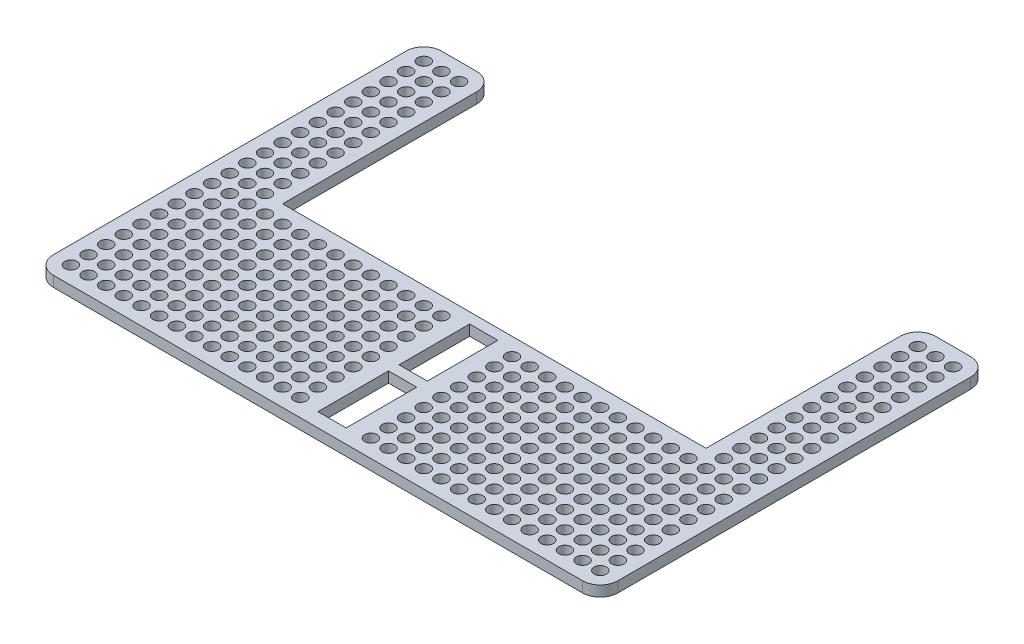
from build123d import *

# Parameters (mm, degrees)
SKETCH1_R           = 1.75
BOSS_EXTRUDE1_DEPTH = 3


with BuildPart() as part:
    # Sketch1 → Boss-Extrude1 (new body)
    with BuildSketch(Plane(origin=(0, 0, 0), x_dir=(1, 0, 0), z_dir=(0, 1, 0))):
        with BuildLine():
            Line((0, -20), (-60, -20))
            Line((-60, -20), (-60, 35))
            ThreePointArc((-60, 35), (-61.464466094, 38.535533906), (-65, 40))
            Line((-65, 40), (-75, 40))
            ThreePointArc((-75, 40), (-78.535533906, 38.535533906), (-80, 35))
            Line((-80, 35), (-80, -65))
            ThreePointArc((-80, -65), (-78.535533906, -68.535533906), (-75, -70))
            Line((-75, -70), (0, -70))
            Line((0, -70), (0, -66))
            Line((0, -66), (-4, -66))
            Line((-4, -66), (-4, -46))
            Line((-4, -46), (0, -46))
            Line((0, -46), (0, -43))
            Line((0, -43), (-4, -43))
            Line((-4, -43), (-4, -23))
            Line((-4, -23), (0, -23))
            Line((0, -23), (0, -20))
        make_face()
        with Locations(Location((-65, 0, 0), (0, 0, 270))):
            Circle(SKETCH1_R, mode=Mode.SUBTRACT)
        with Locations(Location((-70, 0, 0), (0, 0, 270))):
            Circle(SKETCH1_R, mode=Mode.SUBTRACT)
        with Locations(Location((-75, 0, 0), (0, 0, 270))):
            Circle(SKETCH1_R, mode=Mode.SUBTRACT)
        with Locations(Location((-75, 5, 0), (0, 0, 270))):
            Circle(SKETCH1_R, mode=Mode.SUBTRACT)
        with Locations(Location((-70, 5, 0), (0, 0, 270))):
            Circle(SKETCH1_R, mode=Mode.SUBTRACT)
        with Locations(Location((-65, 5, 0), (0, 0, 270))):
            Circle(SKETCH1_R, mode=Mode.SUBTRACT)
        with Locations(Location((-75, 10, 0), (0, 0, 270))):
            Circle(SKETCH1_R, mode=Mode.SUBTRACT)
        with Locations(Location((-70, 10, 0), (0, 0, 270))):
            Circle(SKETCH1_R, mode=Mode.SUBTRACT)
        with Locations(Location((-65, 10, 0), (0, 0, 270))):
            Circle(SKETCH1_R, mode=Mode.SUBTRACT)
        with Locations(Location((-75, 15, 0), (0, 0, 270))):
            Circle(SKETCH1_R, mode=Mode.SUBTRACT)
        with Locations(Location((-70, 15, 0), (0, 0, 270))):
            Circle(SKETCH1_R, mode=Mode.SUBTRACT)
        with Locations(Location((-65, 15, 0), (0, 0, 270))):
            Circle(SKETCH1_R, mode=Mode.SUBTRACT)
        with Locations(Location((-75, 20, 0), (0, 0, 270))):
            Circle(SKETCH1_R, mode=Mode.SUBTRACT)
        with Locations(Location((-70, 20, 0), (0, 0, 270))):
            Circle(SKETCH1_R, mode=Mode.SUBTRACT)
        with Locations(Location((-65, 20, 0), (0, 0, 270))):
            Circle(SKETCH1_R, mode=Mode.SUBTRACT)
        with Locations(Location((-75, 25, 0), (0, 0, 270))):
            Circle(SKETCH1_R, mode=Mode.SUBTRACT)
        with Locations(Location((-70, 25, 0), (0, 0, 270))):
            Circle(SKETCH1_R, mode=Mode.SUBTRACT)
        with Locations(Location((-65, 25, 0), (0, 0, 270))):
            Circle(SKETCH1_R, mode=Mode.SUBTRACT)
        with Locations(Location((-75, 30, 0), (0, 0, 270))):
            Circle(SKETCH1_R, mode=Mode.SUBTRACT)
        with Locations(Location((-70, 30, 0), (0, 0, 270))):
            Circle(SKETCH1_R, mode=Mode.SUBTRACT)
        with Locations(Location((-65, 30, 0), (0, 0, 270))):
            Circle(SKETCH1_R, mode=Mode.SUBTRACT)
        with Locations(Location((-75, 35, 0), (0, 0, 270))):
            Circle(SKETCH1_R, mode=Mode.SUBTRACT)
        with Locations(Location((-70, 35, 0), (0, 0, 270))):
            Circle(SKETCH1_R, mode=Mode.SUBTRACT)
        with Locations(Location((-65, 35, 0), (0, 0, 270))):
            Circle(SKETCH1_R, mode=Mode.SUBTRACT)
        with Locations(Location((-75, -5, 0), (0, 0, 270))):
            Circle(SKETCH1_R, mode=Mode.SUBTRACT)
        with Locations(Location((-70, -5, 0), (0, 0, 270))):
            Circle(SKETCH1_R, mode=Mode.SUBTRACT)
        with Locations(Location((-65, -5, 0), (0, 0, 270))):
            Circle(SKETCH1_R, mode=Mode.SUBTRACT)
        with Locations(Location((-75, -10, 0), (0, 0, 270))):
            Circle(SKETCH1_R, mode=Mode.SUBTRACT)
        with Locations(Location((-70, -10, 0), (0, 0, 270))):
            Circle(SKETCH1_R, mode=Mode.SUBTRACT)
        with Locations(Location((-65, -10, 0), (0, 0, 270))):
            Circle(SKETCH1_R, mode=Mode.SUBTRACT)
        with Locations(Location((-75, -15, 0), (0, 0, 270))):
            Circle(SKETCH1_R, mode=Mode.SUBTRACT)
        with Locations(Location((-70, -15, 0), (0, 0, 270))):
            Circle(SKETCH1_R, mode=Mode.SUBTRACT)
        with Locations(Location((-65, -15, 0), (0, 0, 270))):
            Circle(SKETCH1_R, mode=Mode.SUBTRACT)
        with Locations(Location((-75, -20, 0), (0, 0, 270))):
            Circle(SKETCH1_R, mode=Mode.SUBTRACT)
        with Locations(Location((-70, -20, 0), (0, 0, 270))):
            Circle(SKETCH1_R, mode=Mode.SUBTRACT)
        with Locations(Location((-65, -20, 0), (0, 0, 270))):
            Circle(SKETCH1_R, mode=Mode.SUBTRACT)
        with Locations(Location((-75, -25, 0), (0, 0, 270))):
            Circle(SKETCH1_R, mode=Mode.SUBTRACT)
        with Locations(Location((-70, -25, 0), (0, 0, 270))):
            Circle(SKETCH1_R, mode=Mode.SUBTRACT)
        with Locations(Location((-65, -25, 0), (0, 0, 270))):
            Circle(SKETCH1_R, mode=Mode.SUBTRACT)
        with Locations(Location((-75, -30, 0), (0, 0, 270))):
            Circle(SKETCH1_R, mode=Mode.SUBTRACT)
        with Locations(Location((-70, -30, 0), (0, 0, 270))):
            Circle(SKETCH1_R, mode=Mode.SUBTRACT)
        with Locations(Location((-65, -30, 0), (0, 0, 270))):
            Circle(SKETCH1_R, mode=Mode.SUBTRACT)
        with Locations(Location((-75, -35, 0), (0, 0, 270))):
            Circle(SKETCH1_R, mode=Mode.SUBTRACT)
        with Locations(Location((-70, -35, 0), (0, 0, 270))):
            Circle(SKETCH1_R, mode=Mode.SUBTRACT)
        with Locations(Location((-65, -35, 0), (0, 0, 270))):
            Circle(SKETCH1_R, mode=Mode.SUBTRACT)
        with Locations(Location((-75, -40, 0), (0, 0, 270))):
            Circle(SKETCH1_R, mode=Mode.SUBTRACT)
        with Locations(Location((-70, -40, 0), (0, 0, 270))):
            Circle(SKETCH1_R, mode=Mode.SUBTRACT)
        with Locations(Location((-65, -40, 0), (0, 0, 270))):
            Circle(SKETCH1_R, mode=Mode.SUBTRACT)
        with Locations(Location((-75, -45, 0), (0, 0, 270))):
            Circle(SKETCH1_R, mode=Mode.SUBTRACT)
        with Locations(Location((-70, -45, 0), (0, 0, 270))):
            Circle(SKETCH1_R, mode=Mode.SUBTRACT)
        with Locations(Location((-65, -45, 0), (0, 0, 270))):
            Circle(SKETCH1_R, mode=Mode.SUBTRACT)
        with Locations(Location((-75, -50, 0), (0, 0, 270))):
            Circle(SKETCH1_R, mode=Mode.SUBTRACT)
        with Locations(Location((-70, -50, 0), (0, 0, 270))):
            Circle(SKETCH1_R, mode=Mode.SUBTRACT)
        with Locations(Location((-65, -50, 0), (0, 0, 270))):
            Circle(SKETCH1_R, mode=Mode.SUBTRACT)
        with Locations(Location((-75, -55, 0), (0, 0, 270))):
            Circle(SKETCH1_R, mode=Mode.SUBTRACT)
        with Locations(Location((-70, -55, 0), (0, 0, 270))):
            Circle(SKETCH1_R, mode=Mode.SUBTRACT)
        with Locations(Location((-65, -55, 0), (0, 0, 270))):
            Circle(SKETCH1_R, mode=Mode.SUBTRACT)
        with Locations(Location((-75, -60, 0), (0, 0, 270))):
            Circle(SKETCH1_R, mode=Mode.SUBTRACT)
        with Locations(Location((-70, -60, 0), (0, 0, 270))):
            Circle(SKETCH1_R, mode=Mode.SUBTRACT)
        with Locations(Location((-65, -60, 0), (0, 0, 270))):
            Circle(SKETCH1_R, mode=Mode.SUBTRACT)
        with Locations(Location((-75, -65, 0), (0, 0, 270))):
            Circle(SKETCH1_R, mode=Mode.SUBTRACT)
        with Locations(Location((-70, -65, 0), (0, 0, 270))):
            Circle(SKETCH1_R, mode=Mode.SUBTRACT)
        with Locations(Location((-65, -65, 0), (0, 0, 270))):
            Circle(SKETCH1_R, mode=Mode.SUBTRACT)
        with Locations(Location((-60, -65, 0), (0, 0, 270))):
            Circle(SKETCH1_R, mode=Mode.SUBTRACT)
        with Locations(Location((-60, -60, 0), (0, 0, 270))):
            Circle(SKETCH1_R, mode=Mode.SUBTRACT)
        with Locations(Location((-60, -55, 0), (0, 0, 270))):
            Circle(SKETCH1_R, mode=Mode.SUBTRACT)
        with Locations(Location((-60, -50, 0), (0, 0, 270))):
            Circle(SKETCH1_R, mode=Mode.SUBTRACT)
        with Locations(Location((-60, -45, 0), (0, 0, 270))):
            Circle(SKETCH1_R, mode=Mode.SUBTRACT)
        with Locations(Location((-60, -40, 0), (0, 0, 270))):
            Circle(SKETCH1_R, mode=Mode.SUBTRACT)
        with Locations(Location((-60, -35, 0), (0, 0, 270))):
            Circle(SKETCH1_R, mode=Mode.SUBTRACT)
        with Locations(Location((-60, -30, 0), (0, 0, 270))):
            Circle(SKETCH1_R, mode=Mode.SUBTRACT)
        with Locations(Location((-60, -25, 0), (0, 0, 270))):
            Circle(SKETCH1_R, mode=Mode.SUBTRACT)
        with Locations(Location((-55, -65, 0), (0, 0, 270))):
            Circle(SKETCH1_R, mode=Mode.SUBTRACT)
        with Locations(Location((-55, -60, 0), (0, 0, 270))):
            Circle(SKETCH1_R, mode=Mode.SUBTRACT)
        with Locations(Location((-55, -55, 0), (0, 0, 270))):
            Circle(SKETCH1_R, mode=Mode.SUBTRACT)
        with Locations(Location((-55, -50, 0), (0, 0, 270))):
            Circle(SKETCH1_R, mode=Mode.SUBTRACT)
        with Locations(Location((-55, -45, 0), (0, 0, 270))):
            Circle(SKETCH1_R, mode=Mode.SUBTRACT)
        with Locations(Location((-55, -40, 0), (0, 0, 270))):
            Circle(SKETCH1_R, mode=Mode.SUBTRACT)
        with Locations(Location((-55, -35, 0), (0, 0, 270))):
            Circle(SKETCH1_R, mode=Mode.SUBTRACT)
        with Locations(Location((-55, -30, 0), (0, 0, 270))):
            Circle(SKETCH1_R, mode=Mode.SUBTRACT)
        with Locations(Location((-55, -25, 0), (0, 0, 270))):
            Circle(SKETCH1_R, mode=Mode.SUBTRACT)
        with Locations(Location((-50, -65, 0), (0, 0, 270))):
            Circle(SKETCH1_R, mode=Mode.SUBTRACT)
        with Locations(Location((-50, -60, 0), (0, 0, 270))):
            Circle(SKETCH1_R, mode=Mode.SUBTRACT)
        with Locations(Location((-50, -55, 0), (0, 0, 270))):
            Circle(SKETCH1_R, mode=Mode.SUBTRACT)
        with Locations(Location((-50, -50, 0), (0, 0, 270))):
            Circle(SKETCH1_R, mode=Mode.SUBTRACT)
        with Locations(Location((-50, -45, 0), (0, 0, 270))):
            Circle(SKETCH1_R, mode=Mode.SUBTRACT)
        with Locations(Location((-50, -40, 0), (0, 0, 270))):
            Circle(SKETCH1_R, mode=Mode.SUBTRACT)
        with Locations(Location((-50, -35, 0), (0, 0, 270))):
            Circle(SKETCH1_R, mode=Mode.SUBTRACT)
        with Locations(Location((-50, -30, 0), (0, 0, 270))):
            Circle(SKETCH1_R, mode=Mode.SUBTRACT)
        with Locations(Location((-50, -25, 0), (0, 0, 270))):
            Circle(SKETCH1_R, mode=Mode.SUBTRACT)
        with Locations(Location((-45, -65, 0), (0, 0, 270))):
            Circle(SKETCH1_R, mode=Mode.SUBTRACT)
        with Locations(Location((-45, -60, 0), (0, 0, 270))):
            Circle(SKETCH1_R, mode=Mode.SUBTRACT)
        with Locations(Location((-45, -55, 0), (0, 0, 270))):
            Circle(SKETCH1_R, mode=Mode.SUBTRACT)
        with Locations(Location((-45, -50, 0), (0, 0, 270))):
            Circle(SKETCH1_R, mode=Mode.SUBTRACT)
        with Locations(Location((-45, -45, 0), (0, 0, 270))):
            Circle(SKETCH1_R, mode=Mode.SUBTRACT)
        with Locations(Location((-45, -40, 0), (0, 0, 270))):
            Circle(SKETCH1_R, mode=Mode.SUBTRACT)
        with Locations(Location((-45, -35, 0), (0, 0, 270))):
            Circle(SKETCH1_R, mode=Mode.SUBTRACT)
        with Locations(Location((-45, -30, 0), (0, 0, 270))):
            Circle(SKETCH1_R, mode=Mode.SUBTRACT)
        with Locations(Location((-45, -25, 0), (0, 0, 270))):
            Circle(SKETCH1_R, mode=Mode.SUBTRACT)
        with Locations(Location((-40, -65, 0), (0, 0, 270))):
            Circle(SKETCH1_R, mode=Mode.SUBTRACT)
        with Locations(Location((-40, -60, 0), (0, 0, 270))):
            Circle(SKETCH1_R, mode=Mode.SUBTRACT)
        with Locations(Location((-40, -55, 0), (0, 0, 270))):
            Circle(SKETCH1_R, mode=Mode.SUBTRACT)
        with Locations(Location((-40, -50, 0), (0, 0, 270))):
            Circle(SKETCH1_R, mode=Mode.SUBTRACT)
        with Locations(Location((-40, -45, 0), (0, 0, 270))):
            Circle(SKETCH1_R, mode=Mode.SUBTRACT)
        with Locations(Location((-40, -40, 0), (0, 0, 270))):
            Circle(SKETCH1_R, mode=Mode.SUBTRACT)
        with Locations(Location((-40, -35, 0), (0, 0, 270))):
            Circle(SKETCH1_R, mode=Mode.SUBTRACT)
        with Locations(Location((-40, -30, 0), (0, 0, 270))):
            Circle(SKETCH1_R, mode=Mode.SUBTRACT)
        with Locations(Location((-40, -25, 0), (0, 0, 270))):
            Circle(SKETCH1_R, mode=Mode.SUBTRACT)
        with Locations(Location((-35, -65, 0), (0, 0, 270))):
            Circle(SKETCH1_R, mode=Mode.SUBTRACT)
        with Locations(Location((-35, -60, 0), (0, 0, 270))):
            Circle(SKETCH1_R, mode=Mode.SUBTRACT)
        with Locations(Location((-35, -55, 0), (0, 0, 270))):
            Circle(SKETCH1_R, mode=Mode.SUBTRACT)
        with Locations(Location((-35, -50, 0), (0, 0, 270))):
            Circle(SKETCH1_R, mode=Mode.SUBTRACT)
        with Locations(Location((-35, -45, 0), (0, 0, 270))):
            Circle(SKETCH1_R, mode=Mode.SUBTRACT)
        with Locations(Location((-35, -40, 0), (0, 0, 270))):
            Circle(SKETCH1_R, mode=Mode.SUBTRACT)
        with Locations(Location((-35, -35, 0), (0, 0, 270))):
            Circle(SKETCH1_R, mode=Mode.SUBTRACT)
        with Locations(Location((-35, -30, 0), (0, 0, 270))):
            Circle(SKETCH1_R, mode=Mode.SUBTRACT)
        with Locations(Location((-35, -25, 0), (0, 0, 270))):
            Circle(SKETCH1_R, mode=Mode.SUBTRACT)
        with Locations(Location((-30, -65, 0), (0, 0, 270))):
            Circle(SKETCH1_R, mode=Mode.SUBTRACT)
        with Locations(Location((-30, -60, 0), (0, 0, 270))):
            Circle(SKETCH1_R, mode=Mode.SUBTRACT)
        with Locations(Location((-30, -55, 0), (0, 0, 270))):
            Circle(SKETCH1_R, mode=Mode.SUBTRACT)
        with Locations(Location((-30, -50, 0), (0, 0, 270))):
            Circle(SKETCH1_R, mode=Mode.SUBTRACT)
        with Locations(Location((-30, -45, 0), (0, 0, 270))):
            Circle(SKETCH1_R, mode=Mode.SUBTRACT)
        with Locations(Location((-30, -40, 0), (0, 0, 270))):
            Circle(SKETCH1_R, mode=Mode.SUBTRACT)
        with Locations(Location((-30, -35, 0), (0, 0, 270))):
            Circle(SKETCH1_R, mode=Mode.SUBTRACT)
        with Locations(Location((-30, -30, 0), (0, 0, 270))):
            Circle(SKETCH1_R, mode=Mode.SUBTRACT)
        with Locations(Location((-30, -25, 0), (0, 0, 270))):
            Circle(SKETCH1_R, mode=Mode.SUBTRACT)
        with Locations(Location((-25, -65, 0), (0, 0, 270))):
            Circle(SKETCH1_R, mode=Mode.SUBTRACT)
        with Locations(Location((-25, -60, 0), (0, 0, 270))):
            Circle(SKETCH1_R, mode=Mode.SUBTRACT)
        with Locations(Location((-25, -55, 0), (0, 0, 270))):
            Circle(SKETCH1_R, mode=Mode.SUBTRACT)
        with Locations(Location((-25, -50, 0), (0, 0, 270))):
            Circle(SKETCH1_R, mode=Mode.SUBTRACT)
        with Locations(Location((-25, -45, 0), (0, 0, 270))):
            Circle(SKETCH1_R, mode=Mode.SUBTRACT)
        with Locations(Location((-25, -40, 0), (0, 0, 270))):
            Circle(SKETCH1_R, mode=Mode.SUBTRACT)
        with Locations(Location((-25, -35, 0), (0, 0, 270))):
            Circle(SKETCH1_R, mode=Mode.SUBTRACT)
        with Locations(Location((-25, -30, 0), (0, 0, 270))):
            Circle(SKETCH1_R, mode=Mode.SUBTRACT)
        with Locations(Location((-25, -25, 0), (0, 0, 270))):
            Circle(SKETCH1_R, mode=Mode.SUBTRACT)
        with Locations(Location((-20, -65, 0), (0, 0, 270))):
            Circle(SKETCH1_R, mode=Mode.SUBTRACT)
        with Locations(Location((-20, -60, 0), (0, 0, 270))):
            Circle(SKETCH1_R, mode=Mode.SUBTRACT)
        with Locations(Location((-20, -55, 0), (0, 0, 270))):
            Circle(SKETCH1_R, mode=Mode.SUBTRACT)
        with Locations(Location((-20, -50, 0), (0, 0, 270))):
            Circle(SKETCH1_R, mode=Mode.SUBTRACT)
        with Locations(Location((-20, -45, 0), (0, 0, 270))):
            Circle(SKETCH1_R, mode=Mode.SUBTRACT)
        with Locations(Location((-20, -40, 0), (0, 0, 270))):
            Circle(SKETCH1_R, mode=Mode.SUBTRACT)
        with Locations(Location((-20, -35, 0), (0, 0, 270))):
            Circle(SKETCH1_R, mode=Mode.SUBTRACT)
        with Locations(Location((-20, -30, 0), (0, 0, 270))):
            Circle(SKETCH1_R, mode=Mode.SUBTRACT)
        with Locations(Location((-20, -25, 0), (0, 0, 270))):
            Circle(SKETCH1_R, mode=Mode.SUBTRACT)
        with Locations(Location((-15, -65, 0), (0, 0, 270))):
            Circle(SKETCH1_R, mode=Mode.SUBTRACT)
        with Locations(Location((-15, -60, 0), (0, 0, 270))):
            Circle(SKETCH1_R, mode=Mode.SUBTRACT)
        with Locations(Location((-15, -55, 0), (0, 0, 270))):
            Circle(SKETCH1_R, mode=Mode.SUBTRACT)
        with Locations(Location((-15, -50, 0), (0, 0, 270))):
            Circle(SKETCH1_R, mode=Mode.SUBTRACT)
        with Locations(Location((-15, -45, 0), (0, 0, 270))):
            Circle(SKETCH1_R, mode=Mode.SUBTRACT)
        with Locations(Location((-15, -40, 0), (0, 0, 270))):
            Circle(SKETCH1_R, mode=Mode.SUBTRACT)
        with Locations(Location((-15, -35, 0), (0, 0, 270))):
            Circle(SKETCH1_R, mode=Mode.SUBTRACT)
        with Locations(Location((-15, -30, 0), (0, 0, 270))):
            Circle(SKETCH1_R, mode=Mode.SUBTRACT)
        with Locations(Location((-15, -25, 0), (0, 0, 270))):
            Circle(SKETCH1_R, mode=Mode.SUBTRACT)
        with Locations(Location((-10, -65, 0), (0, 0, 270))):
            Circle(SKETCH1_R, mode=Mode.SUBTRACT)
        with Locations(Location((-10, -60, 0), (0, 0, 270))):
            Circle(SKETCH1_R, mode=Mode.SUBTRACT)
        with Locations(Location((-10, -55, 0), (0, 0, 270))):
            Circle(SKETCH1_R, mode=Mode.SUBTRACT)
        with Locations(Location((-10, -50, 0), (0, 0, 270))):
            Circle(SKETCH1_R, mode=Mode.SUBTRACT)
        with Locations(Location((-10, -45, 0), (0, 0, 270))):
            Circle(SKETCH1_R, mode=Mode.SUBTRACT)
        with Locations(Location((-10, -40, 0), (0, 0, 270))):
            Circle(SKETCH1_R, mode=Mode.SUBTRACT)
        with Locations(Location((-10, -35, 0), (0, 0, 270))):
            Circle(SKETCH1_R, mode=Mode.SUBTRACT)
        with Locations(Location((-10, -30, 0), (0, 0, 270))):
            Circle(SKETCH1_R, mode=Mode.SUBTRACT)
        with Locations(Location((-10, -25, 0), (0, 0, 270))):
            Circle(SKETCH1_R, mode=Mode.SUBTRACT)
    boss_extrude1 = extrude(amount=BOSS_EXTRUDE1_DEPTH)

    # Mirror1: Boss-Extrude1 across plane
    add(boss_extrude1.mirror(Plane(origin=(0, 0, 0), x_dir=(0, 0, 1), z_dir=(1, 0, 0))))


solid = part.part
